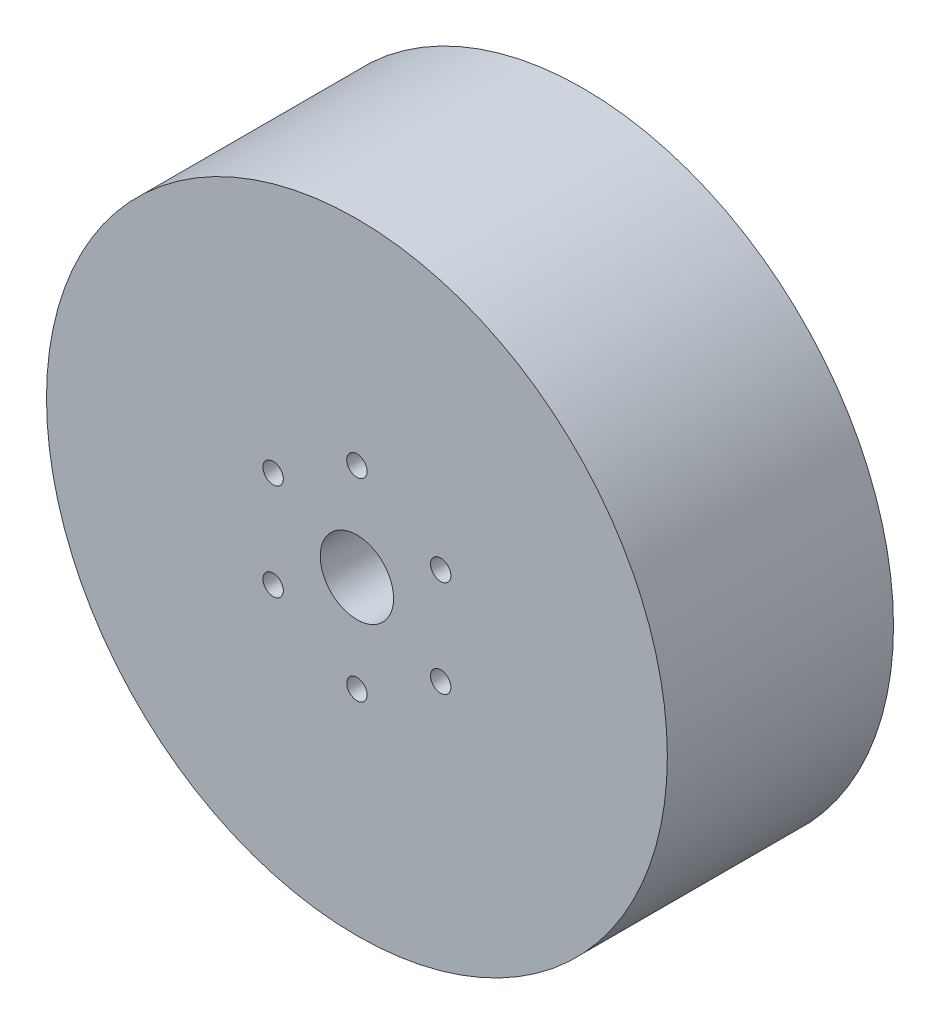
from build123d import *

# Parameters (mm, degrees)
SKETCH1_R           = 76.2
SKETCH1_R_2         = 9
SKETCH1_R_3         = 2.5
BOSS_EXTRUDE1_DEPTH = 55.52


with BuildPart() as part:
    # Sketch1 → Boss-Extrude1 (new body)
    with BuildSketch(Plane.XY):
        Circle(SKETCH1_R)
        Circle(SKETCH1_R_2, mode=Mode.SUBTRACT)
        with Locations((0, 23.75)):
            Circle(SKETCH1_R_3, mode=Mode.SUBTRACT)
        with Locations((20.56860334, 11.875866025)):
            Circle(SKETCH1_R_3, mode=Mode.SUBTRACT)
        with Locations((20.56960334, -11.874133975)):
            Circle(SKETCH1_R_3, mode=Mode.SUBTRACT)
        with Locations((0.002, -23.75)):
            Circle(SKETCH1_R_3, mode=Mode.SUBTRACT)
        with Locations((-20.56660334, -11.875866025)):
            Circle(SKETCH1_R_3, mode=Mode.SUBTRACT)
        with Locations((-20.56760334, 11.874133975)):
            Circle(SKETCH1_R_3, mode=Mode.SUBTRACT)
    extrude(amount=BOSS_EXTRUDE1_DEPTH)


solid = part.part
